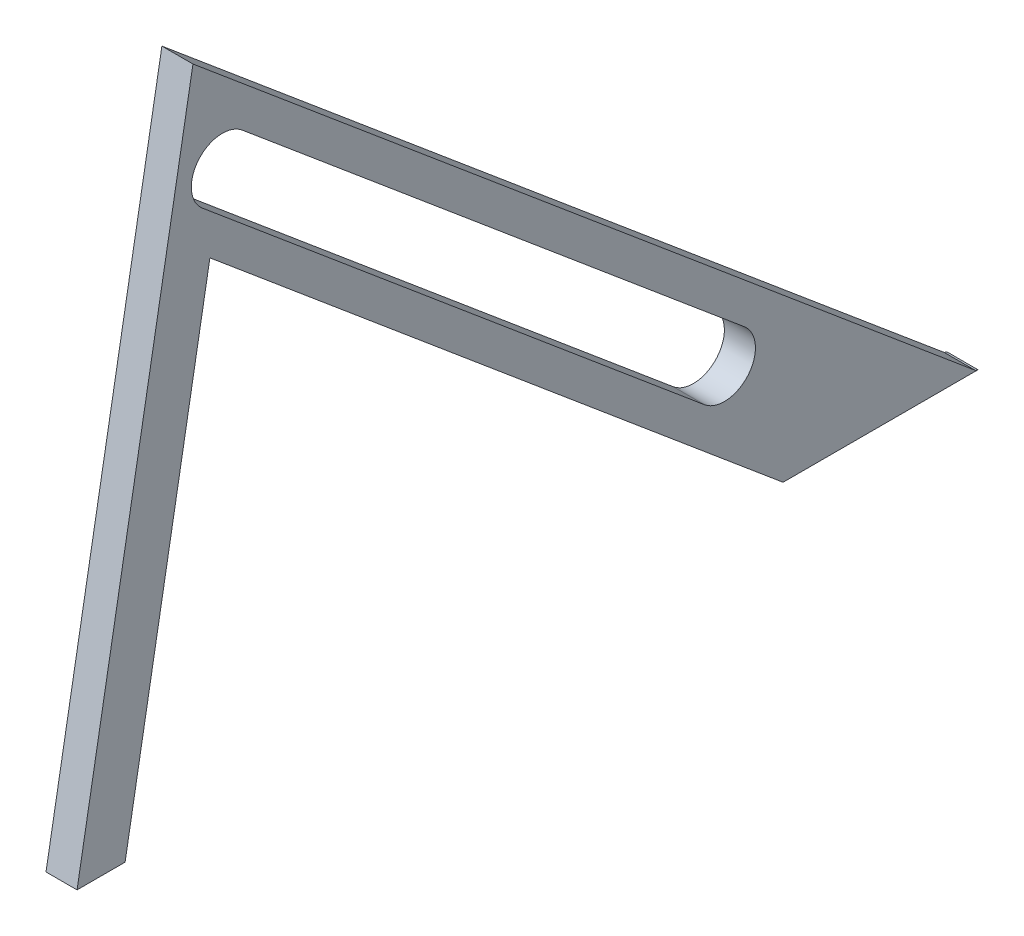
from build123d import *

# Parameters (mm, degrees)
BOSS_EXTRUDE1_DEPTH = 12.7


with BuildPart() as part:
    # Sketch1 → Boss-Extrude1 (new body)
    with BuildSketch(Plane(origin=(0, 0, 0), x_dir=(0, 0, -1), z_dir=(1, 0, 0))):
        Polygon((-397.092904294, 268.859), (-444.5, 0), (-424.843977237, 0), (-390.15626708, 196.723779974), (-269.739557089, 95.682163033), (-155.709995547, 0), (-75.979077973, 0), (-77.07898874, 0.335441487), align=None)
        with BuildLine():
            Line((-376.899868673, 235.336358684), (-171.5539558, 63.030678928))
            ThreePointArc((-171.5539558, 63.030678928), (-169.988594016, 45.138511858), (-187.880761086, 43.573150073))
            Line((-187.880761086, 43.573150073), (-393.226673959, 215.878829829))
            ThreePointArc((-393.226673959, 215.878829829), (-394.792035744, 233.7709969), (-376.899868673, 235.336358684))
        make_face(mode=Mode.SUBTRACT)
    extrude(amount=BOSS_EXTRUDE1_DEPTH)


solid = part.part
